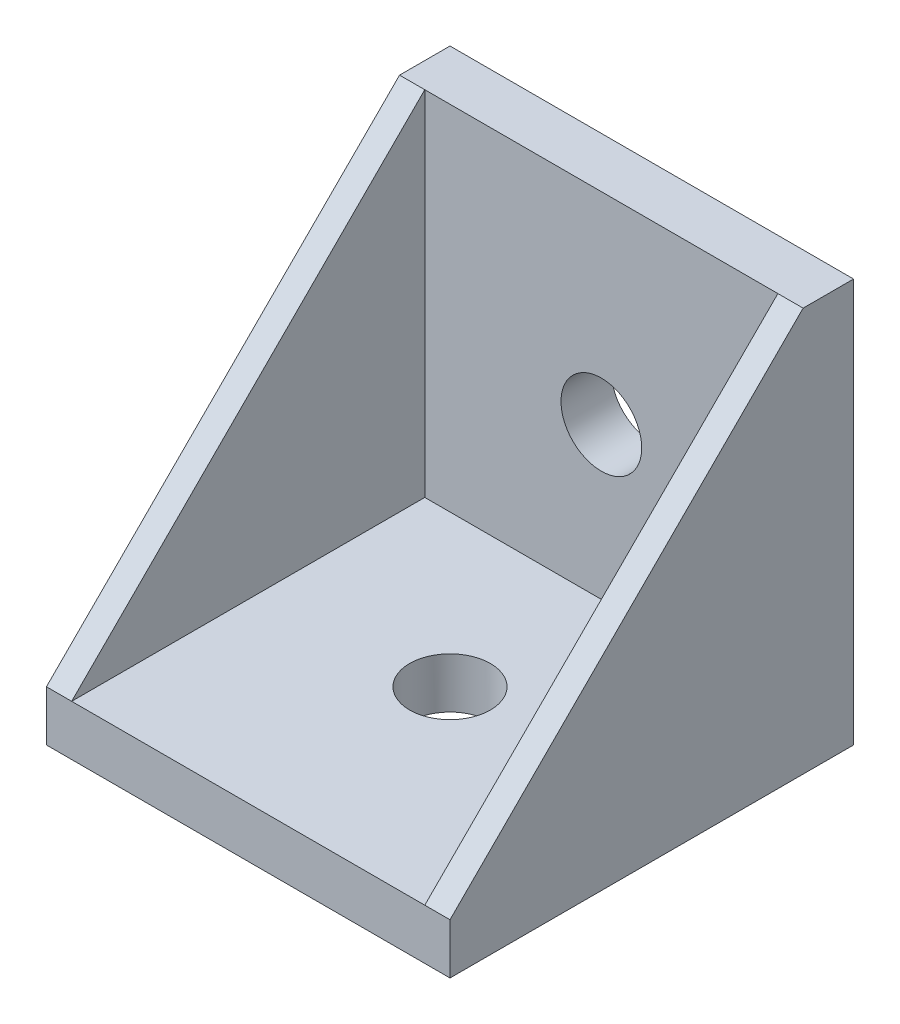
from build123d import *

# Parameters (mm, degrees)
SKETCH1_W               = 40
SKETCH1_H               = 40
BOSS_EXTRUDE1_DEPTH     = 40
CUT_EXTRUDE1_DEPTH      = 61
CUT_EXTRUDE1_DEPTH_BACK = 61
CUT_EXTRUDE2_DEPTH      = 61
CUT_EXTRUDE2_DEPTH_BACK = 35
SKETCH4_W               = 35
SKETCH4_H               = 35
CUT_EXTRUDE3_DEPTH      = 57.789083458
CUT_EXTRUDE3_DEPTH_BACK = 57.789083458
SKETCH6_R               = 4
CUT_EXTRUDE4_DEPTH      = 46
CUT_EXTRUDE4_DEPTH_BACK = 46
SKETCH5_R               = 4


with BuildPart() as part:
    # Sketch1 → Boss-Extrude1 (new body)
    with BuildSketch(Plane(origin=(0, 0, 0), x_dir=(1, 0, 0), z_dir=(0, 1, 0))):
        Rectangle(SKETCH1_W, SKETCH1_H)
    extrude(amount=BOSS_EXTRUDE1_DEPTH)

    # Sketch2 → Cut-Extrude1 (cut, two sides: drawn at the far end of the back side and taken through both)
    with BuildSketch(Plane(origin=(20, 0, 0), x_dir=(0, 0, -1), z_dir=(1, 0, 0)).offset(-CUT_EXTRUDE1_DEPTH_BACK)):
        Polygon((15, 40), (-20, 5), (-20, 40), align=None)
    extrude(amount=CUT_EXTRUDE1_DEPTH + CUT_EXTRUDE1_DEPTH_BACK, mode=Mode.SUBTRACT)

    # Sketch4 → Cut-Extrude2 (cut, two sides: drawn at the far end of the back side and taken through both)
    with BuildSketch(Plane.XY.offset(20).offset(-CUT_EXTRUDE2_DEPTH_BACK)):
        with Locations((0, 22.5)):
            Rectangle(SKETCH4_W, SKETCH4_H)
    extrude(amount=CUT_EXTRUDE2_DEPTH + CUT_EXTRUDE2_DEPTH_BACK, mode=Mode.SUBTRACT)

    # Sketch6 → Cut-Extrude3 (cut, two sides: drawn at the far end of the back side and taken through both)
    with BuildSketch(Plane.XY.offset(-15).offset(-CUT_EXTRUDE3_DEPTH_BACK)):
        with Locations((0, 20)):
            Circle(SKETCH6_R)
    extrude(amount=CUT_EXTRUDE3_DEPTH + CUT_EXTRUDE3_DEPTH_BACK, mode=Mode.SUBTRACT)

    # Sketch5 → Cut-Extrude4 (cut, two sides: drawn at the far end of the back side and taken through both)
    with BuildSketch(Plane(origin=(0, 5, 0), x_dir=(1, 0, 0), z_dir=(0, 1, 0)).offset(-CUT_EXTRUDE4_DEPTH_BACK)):
        with Locations(Location((0, 0, 0), (0, 0, 270))):
            Circle(SKETCH5_R)
    extrude(amount=CUT_EXTRUDE4_DEPTH + CUT_EXTRUDE4_DEPTH_BACK, mode=Mode.SUBTRACT)


solid = part.part
